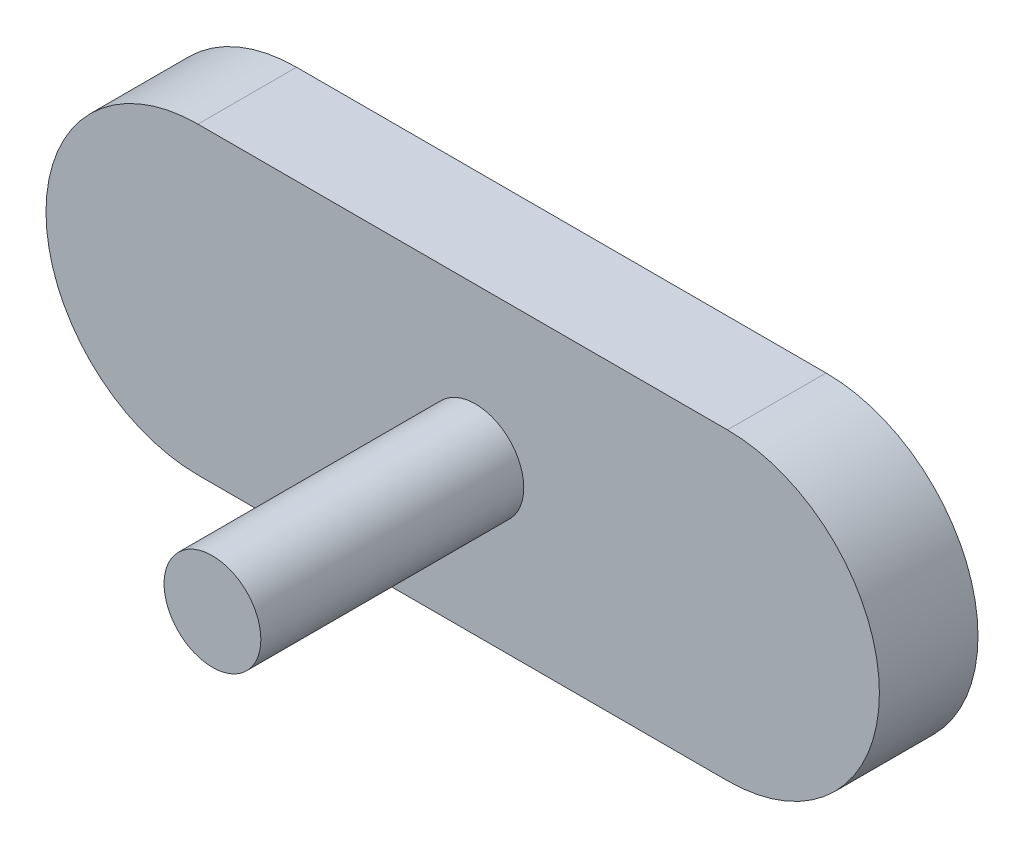
from build123d import *

# Parameters (mm, degrees)
EXTRUDE_1_DEPTH = 3
SKETCH_2_R      = 1.472329888
EXTRUDE_2_DEPTH = 8


with BuildPart() as part:
    # 草图1 → 凸台-拉伸1 (new body)
    with BuildSketch(Plane.XY):
        with BuildLine():
            Line((-8.441718654, 4.62364067), (7.670804568, 4.62364067))
            ThreePointArc((7.670804568, 4.62364067), (12.294445238, 0), (7.670804568, -4.62364067))
            Line((7.670804568, -4.62364067), (-8.441718654, -4.62364067))
            ThreePointArc((-8.441718654, -4.62364067), (-13.065359324, 0), (-8.441718654, 4.62364067))
        make_face()
    extrude(amount=EXTRUDE_1_DEPTH)

    # 草图2 → 凸台-拉伸2 (add)
    with BuildSketch(Plane.XY.offset(3)):
        Circle(SKETCH_2_R)
    extrude(amount=EXTRUDE_2_DEPTH)


solid = part.part
